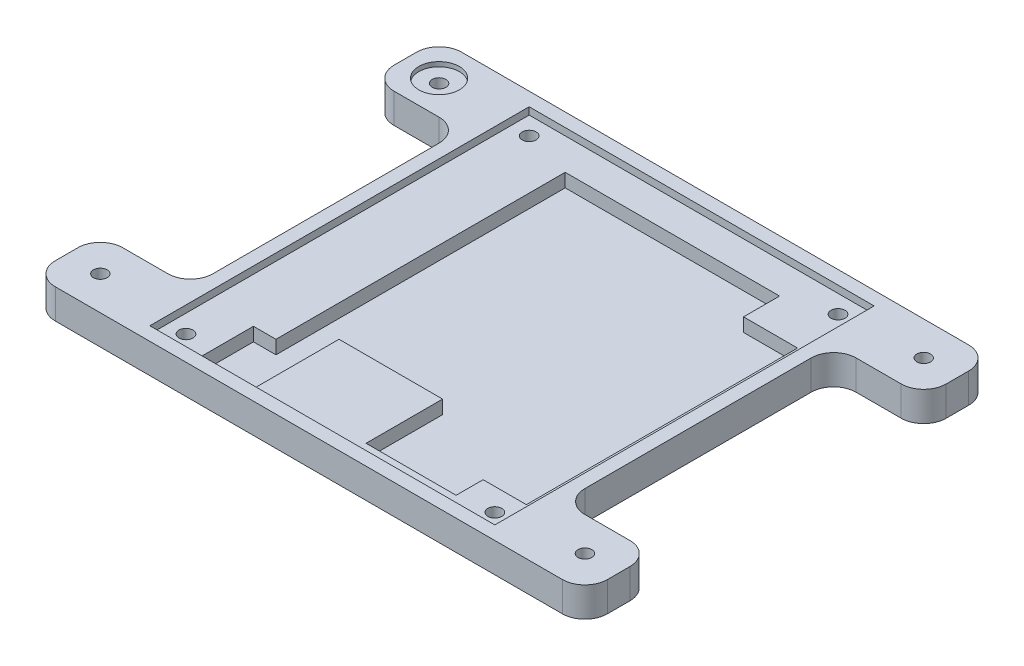
from build123d import *

# Parameters (mm, degrees)
BOSS_EXTRUDE1_DEPTH = 6.6
SKETCH2_5_W         = 76.6
SKETCH2_5_H         = 84.22
CUT_EXTRUDE9_DEPTH  = 1.6
CUT_EXTRUDE10_DEPTH = 3
SKETCH2_R           = 1.55
CUT_EXTRUDE3_DEPTH  = 90.468527235
FILLET1_R           = 5
SKETCH5_R           = 1.525
CUT_EXTRUDE4_DEPTH  = 10
SKETCH5_3_R         = 4.5
CUT_EXTRUDE5_DEPTH  = 1
CUT_EXTRUDE6_DEPTH  = 2.4


with BuildPart() as part:
    # Sketch1 → Boss-Extrude1 (new body)
    with BuildSketch(Plane(origin=(0, 0, 0), x_dir=(1, 0, 0), z_dir=(0, 1, 0))):
        Polygon((-36.907015775, 45.377886591), (-36.907015775, -14.842113409), (-56.907015775, -14.842113409), (-56.907015775, -29.842113409), (-44.307015775, -29.842113409), (45.692984225, -29.842113409), (65.692984225, -29.842113409), (65.692984225, -14.842113409), (45.692984225, -14.842113409), (45.692984225, 45.377886591), (65.692984225, 45.377886591), (65.692984225, 60.377886591), (45.692984225, 60.377886591), (-44.307015775, 60.377886591), (-56.907015775, 60.377886591), (-56.907015775, 45.377886591), align=None)
    extrude(amount=BOSS_EXTRUDE1_DEPTH)

    # Sketch2<5> → Cut-Extrude9 (cut)
    with BuildSketch(Plane(origin=(0, 6.6, 0), x_dir=(1, 0, 0), z_dir=(0, 1, 0))):
        with Locations((4.392984225, 15.267886591)):
            Rectangle(SKETCH2_5_W, SKETCH2_5_H)
    extrude(amount=-CUT_EXTRUDE9_DEPTH, mode=Mode.SUBTRACT)

    # Sketch11 → Cut-Extrude10 (cut)
    with BuildSketch(Plane(origin=(0, 5, 0), x_dir=(1, 0, 0), z_dir=(0, 1, 0))):
        Polygon((-18.907015775, 50.377886591), (-18.907015775, -13.842113409), (-23.907015775, -13.842113409), (-23.907015775, -26.842113409), (-11.907015775, -26.842113409), (-11.907015775, -6.842113409), (11.092984225, -6.842113409), (11.092984225, -23.842113409), (31.092984225, -23.842113409), (31.092984225, -17.842113409), (40.692984225, -17.842113409), (40.692984225, 42.377886591), (28.692984225, 42.377886591), (28.692984225, 50.377886591), align=None)
    extrude(amount=-CUT_EXTRUDE10_DEPTH, mode=Mode.SUBTRACT)

    # Sketch2 → Cut-Extrude3 (cut, through all)
    with BuildSketch(Plane(origin=(0, 6.6, 0), x_dir=(1, 0, 0), z_dir=(0, 1, 0))):
        with Locations((38.682984225, 53.367886591)):
            Circle(SKETCH2_R)
        with Locations((-29.897015775, 53.367886591)):
            Circle(SKETCH2_R)
        with Locations((-29.897015775, -22.832113409)):
            Circle(SKETCH2_R)
        with Locations((38.682984225, -22.832113409)):
            Circle(SKETCH2_R)
    extrude(amount=-CUT_EXTRUDE3_DEPTH, mode=Mode.SUBTRACT)

    # Fillet1
    fillet1_edges = [part.edges().sort_by_distance(p)[0] for p in [
        (-56.907015775, 3.3, -45.377886591),
        (-56.907015775, 3.3, -60.377886591),
        (-56.907015775, 3.3, 29.842113409),
        (65.692984225, 3.3, -60.377886591),
        (45.692984225, 3.3, -45.377886591),
        (65.692984225, 3.3, -45.377886591),
        (65.692984225, 3.3, 29.842113409),
        (-56.907015775, 3.3, 14.842113409),
        (65.692984225, 3.3, 14.842113409),
        (45.692984225, 3.3, 14.842113409),
        (-36.907015775, 3.3, 14.842113409),
        (-36.907015775, 3.3, -45.377886591),
    ]]
    fillet(fillet1_edges, radius=FILLET1_R)

    # Sketch5 → Cut-Extrude4 (cut)
    with BuildSketch(Plane(origin=(0, 6.6, 0), x_dir=(1, 0, 0), z_dir=(0, 1, 0))):
        with Locations((-49.407015775, 52.877886591)):
            Circle(SKETCH5_R)
        with Locations((-49.407015775, -22.342113409)):
            Circle(SKETCH5_R)
        with Locations((58.192984225, -22.342113409)):
            Circle(SKETCH5_R)
        with Locations((58.192984225, 52.877886591)):
            Circle(SKETCH5_R)
    extrude(amount=-CUT_EXTRUDE4_DEPTH, mode=Mode.SUBTRACT)

    # Sketch5<3> → Cut-Extrude5 (cut)
    with BuildSketch(Plane(origin=(0, 6.6, 0), x_dir=(1, 0, 0), z_dir=(0, 1, 0))):
        with Locations((-49.407015775, 52.877886591)):
            Circle(SKETCH5_3_R)
    extrude(amount=-CUT_EXTRUDE5_DEPTH, mode=Mode.SUBTRACT)

    # Sketch6 → Cut-Extrude6 (cut)
    with BuildSketch(Plane.XZ):
        Polygon((-52.610843031, 22.396802624), (-51.056291653, 19.594862223), (-47.852464396, 19.540173008), (-46.203188518, 22.287424193), (-47.757739897, 25.089364595), (-50.961567153, 25.14405381), align=None)
        Polygon((58.333022061, 25.543345891), (55.49065449, 24.064005973), (55.350616655, 20.862773491), (58.05294639, 19.140880927), (60.895313961, 20.620220845), (61.035351796, 23.821453327), align=None)
        Polygon((60.566668821, -50.725417907), (57.515733962, -49.745981088), (55.142049366, -51.898449773), (55.819299629, -55.030355276), (58.870234489, -56.009792094), (61.243919085, -53.85732341), align=None)
        Polygon((-52.611149193, -52.845807944), (-51.036863407, -55.636708205), (-47.832729989, -55.668786852), (-46.202882357, -52.909965238), (-47.777168142, -50.119064978), (-50.98130156, -50.086986331), align=None)
        Polygon((-26.956477298, 21.559033103), (-27.32422665, 24.742154278), (-30.264765127, 26.015234584), (-32.837554252, 24.105193715), (-32.469804899, 20.92207254), (-29.529266422, 19.648992234), align=None)
        Polygon((41.318077345, 21.008988549), (41.579403227, 24.202608562), (38.944310108, 26.025733421), (36.047891106, 24.655238268), (35.786565223, 21.461618256), (38.421658342, 19.638493396), align=None)
        Polygon((41.435867732, -55.007744024), (41.479584174, -51.803748257), (38.726700668, -50.163890825), (35.930100719, -51.728029158), (35.886384277, -54.932024925), (38.639267783, -56.571882358), align=None)
        Polygon((-26.703291591, -53.627936278), (-28.074944048, -50.732065159), (-31.268668231, -50.472015472), (-33.090739958, -53.107836904), (-31.719087502, -56.003708023), (-28.525363318, -56.26375771), align=None)
    extrude(amount=-CUT_EXTRUDE6_DEPTH, mode=Mode.SUBTRACT)


solid = part.part
